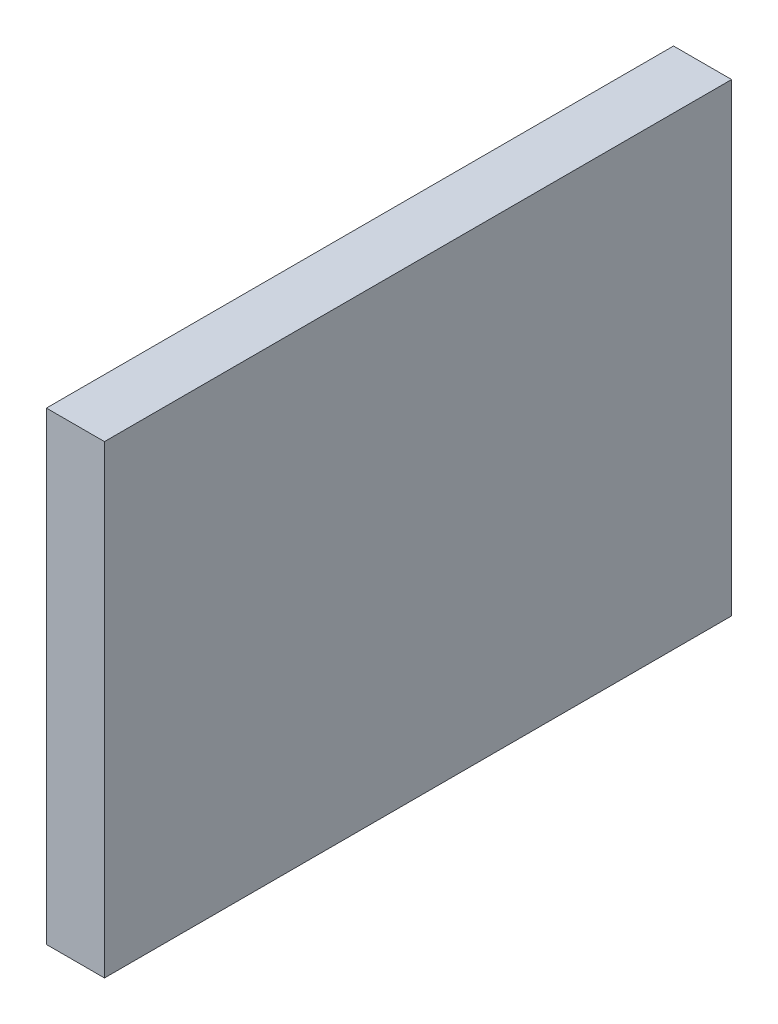
from build123d import *

# Parameters (mm, degrees)
SKETCH1_W           = 68.58
SKETCH1_H           = 50.8
BOSS_EXTRUDE1_DEPTH = 6.35


with BuildPart() as part:
    # Sketch1 → Boss-Extrude1 (new body)
    with BuildSketch(Plane(origin=(0, 0, 0), x_dir=(0, 0, -1), z_dir=(1, 0, 0))):
        Rectangle(SKETCH1_W, SKETCH1_H)
    extrude(amount=BOSS_EXTRUDE1_DEPTH)


solid = part.part
